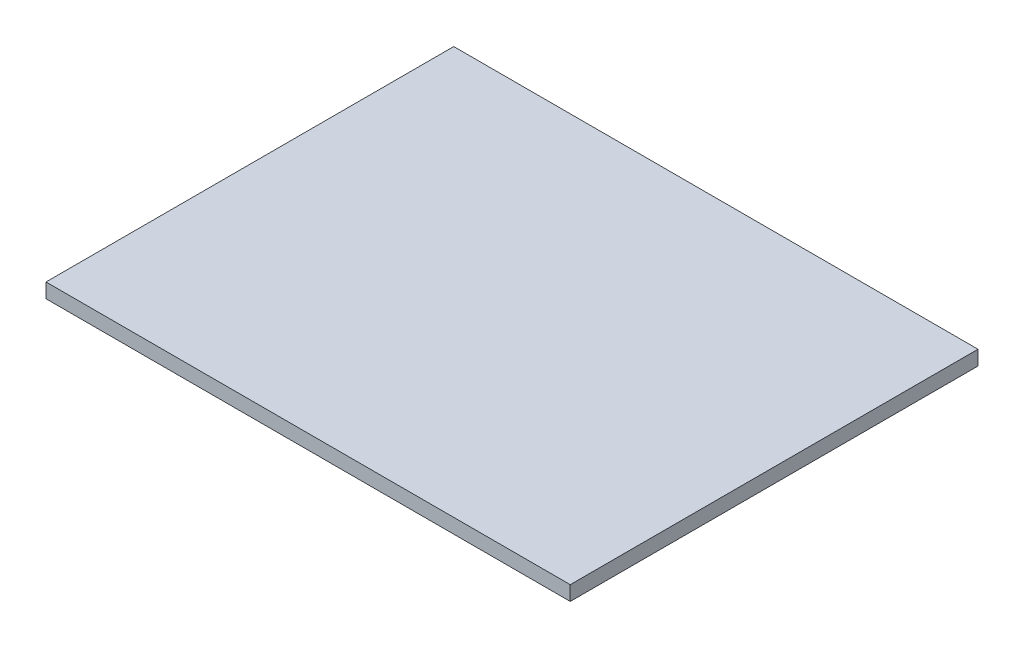
from build123d import *

# Parameters (mm, degrees)
IZIM1_W                     = 180
IZIM1_H                     = 140
Y_KSEKLIK_EKSTR_ZYON1_DEPTH = 5


with BuildPart() as part:
    # Çizim1 → Yükseklik-Ekstrüzyon1 (new body)
    with BuildSketch(Plane(origin=(0, 0, 0), x_dir=(1, 0, 0), z_dir=(0, 1, 0))):
        Rectangle(IZIM1_W, IZIM1_H)
    extrude(amount=Y_KSEKLIK_EKSTR_ZYON1_DEPTH)


solid = part.part
